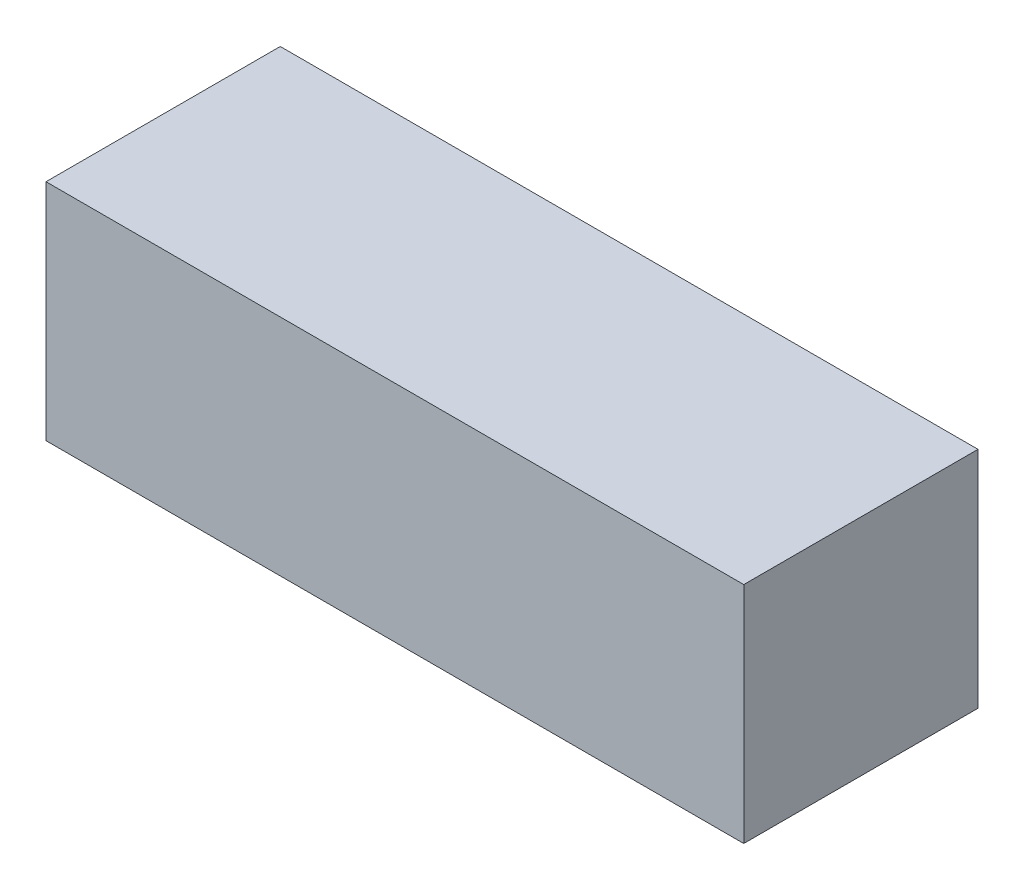
from build123d import *

# Parameters (mm, degrees)
SKETCH1_W           = 140
SKETCH1_H           = 45
BOSS_EXTRUDE1_DEPTH = 47


with BuildPart() as part:
    # Sketch1 → Boss-Extrude1 (new body)
    with BuildSketch(Plane.XY):
        with Locations((70, 22.5)):
            Rectangle(SKETCH1_W, SKETCH1_H)
    extrude(amount=BOSS_EXTRUDE1_DEPTH)


solid = part.part
